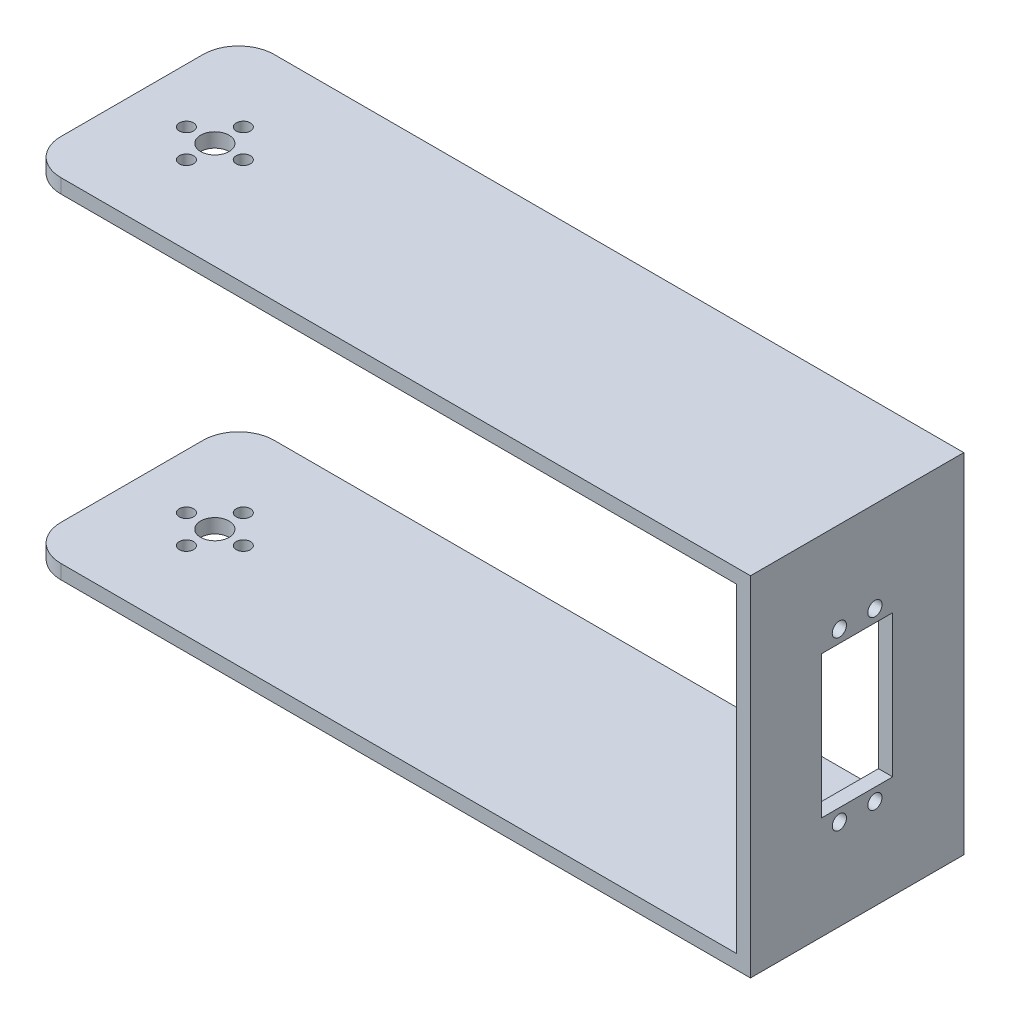
from build123d import *

# Parameters (mm, degrees)
EKSTR_ZYON_NCE1_DEPTH = 60
RADYUS1_R             = 10
KES_EKSTR_ZYON1_REACH = 236.137
IZIM2_R               = 4
IZIM2_R_2             = 2
KES_EKSTR_ZYON2_REACH = 234.491
IZIM3_R               = 2
IZIM3_W               = 20
IZIM3_H               = 40


with BuildPart() as part:
    # Çizim1 → Ekstrüzyon-İnce1 (new body)
    with BuildSketch(Plane.XY):
        Polygon((0, 0), (200, 0), (200, 90), (0, 90), (0, 94), (204, 94), (204, -4), (0, -4), align=None)
    extrude(amount=EKSTR_ZYON_NCE1_DEPTH)

    # Radyus1
    radyus1_edges = [part.edges().sort_by_distance(p)[0] for p in [
        (0, -2, 60),
        (0, 92, 60),
        (0, -2, 0),
        (0, 92, 0),
    ]]
    fillet(radyus1_edges, radius=RADYUS1_R)

    # Çizim2 → Kes-Ekstrüzyon1 (cut, up to next)
    with BuildSketch(Plane(origin=(0, 94, 0), x_dir=(1, 0, 0), z_dir=(0, 1, 0)), mode=Mode.PRIVATE) as kes_ekstr_zyon1_sk1:
        with Locations(Location((23.318126504, -30, 0), (0, 0, 270))):
            Circle(IZIM2_R)
    kes_ekstr_zyon1_tool1 = extrude(kes_ekstr_zyon1_sk1.sketch, amount=-KES_EKSTR_ZYON1_REACH, mode=Mode.PRIVATE) & part.part
    # Çizim2 → Kes-Ekstrüzyon1 (cut, up to next)
    with BuildSketch(Plane(origin=(0, 94, 0), x_dir=(1, 0, 0), z_dir=(0, 1, 0)), mode=Mode.PRIVATE) as kes_ekstr_zyon1_sk2:
        with Locations(Location((23.318126504, -22, 0), (0, 0, 270))):
            Circle(IZIM2_R_2)
    kes_ekstr_zyon1_tool2 = extrude(kes_ekstr_zyon1_sk2.sketch, amount=-KES_EKSTR_ZYON1_REACH, mode=Mode.PRIVATE) & part.part
    # Çizim2 → Kes-Ekstrüzyon1 (cut, up to next)
    with BuildSketch(Plane(origin=(0, 94, 0), x_dir=(1, 0, 0), z_dir=(0, 1, 0)), mode=Mode.PRIVATE) as kes_ekstr_zyon1_sk3:
        with Locations(Location((23.318126504, -38, 0), (0, 0, 270))):
            Circle(IZIM2_R_2)
    kes_ekstr_zyon1_tool3 = extrude(kes_ekstr_zyon1_sk3.sketch, amount=-KES_EKSTR_ZYON1_REACH, mode=Mode.PRIVATE) & part.part
    # Çizim2 → Kes-Ekstrüzyon1 (cut, up to next)
    with BuildSketch(Plane(origin=(0, 94, 0), x_dir=(1, 0, 0), z_dir=(0, 1, 0)), mode=Mode.PRIVATE) as kes_ekstr_zyon1_sk4:
        with Locations(Location((31.318126504, -30, 0), (0, 0, 270))):
            Circle(IZIM2_R_2)
    kes_ekstr_zyon1_tool4 = extrude(kes_ekstr_zyon1_sk4.sketch, amount=-KES_EKSTR_ZYON1_REACH, mode=Mode.PRIVATE) & part.part
    # Çizim2 → Kes-Ekstrüzyon1 (cut, up to next)
    with BuildSketch(Plane(origin=(0, 94, 0), x_dir=(1, 0, 0), z_dir=(0, 1, 0)), mode=Mode.PRIVATE) as kes_ekstr_zyon1_sk5:
        with Locations(Location((15.318126504, -30, 0), (0, 0, 270))):
            Circle(IZIM2_R_2)
    kes_ekstr_zyon1_tool5 = extrude(kes_ekstr_zyon1_sk5.sketch, amount=-KES_EKSTR_ZYON1_REACH, mode=Mode.PRIVATE) & part.part
    kes_ekstr_zyon1_1 = kes_ekstr_zyon1_tool1.solids().sort_by_distance((23.318127, 94, 30))[0]
    add(kes_ekstr_zyon1_1, mode=Mode.SUBTRACT)
    kes_ekstr_zyon1_2 = kes_ekstr_zyon1_tool2.solids().sort_by_distance((23.318127, 94, 22))[0]
    add(kes_ekstr_zyon1_2, mode=Mode.SUBTRACT)
    kes_ekstr_zyon1_3 = kes_ekstr_zyon1_tool3.solids().sort_by_distance((23.318127, 94, 38))[0]
    add(kes_ekstr_zyon1_3, mode=Mode.SUBTRACT)
    kes_ekstr_zyon1_4 = kes_ekstr_zyon1_tool4.solids().sort_by_distance((31.318127, 94, 30))[0]
    add(kes_ekstr_zyon1_4, mode=Mode.SUBTRACT)
    kes_ekstr_zyon1_5 = kes_ekstr_zyon1_tool5.solids().sort_by_distance((15.318127, 94, 30))[0]
    add(kes_ekstr_zyon1_5, mode=Mode.SUBTRACT)
    kes_ekstr_zyon1 = kes_ekstr_zyon1_1 + kes_ekstr_zyon1_2 + kes_ekstr_zyon1_3 + kes_ekstr_zyon1_4 + kes_ekstr_zyon1_5  # Kes-Ekstrüzyon1 as one shape, for the pattern or mirror that repeats it

    # Aynalama1: Kes-Ekstrüzyon1 across plane
    add(kes_ekstr_zyon1.mirror(Plane.ZX.offset(45)), mode=Mode.SUBTRACT)

    # Çizim3 → Kes-Ekstrüzyon2 (cut, up to next)
    with BuildSketch(Plane(origin=(204, 0, 0), x_dir=(0, 0, -1), z_dir=(1, 0, 0)), mode=Mode.PRIVATE) as kes_ekstr_zyon2_sk1:
        with Locations((-25, 68.5)):
            Circle(IZIM3_R)
    kes_ekstr_zyon2_tool1 = extrude(kes_ekstr_zyon2_sk1.sketch, amount=-KES_EKSTR_ZYON2_REACH, mode=Mode.PRIVATE) & part.part
    # Çizim3 → Kes-Ekstrüzyon2 (cut, up to next)
    with BuildSketch(Plane(origin=(204, 0, 0), x_dir=(0, 0, -1), z_dir=(1, 0, 0)), mode=Mode.PRIVATE) as kes_ekstr_zyon2_sk2:
        with Locations(Location((-35, 68.5, 0), (0, 0, 180))):
            Circle(IZIM3_R)
    kes_ekstr_zyon2_tool2 = extrude(kes_ekstr_zyon2_sk2.sketch, amount=-KES_EKSTR_ZYON2_REACH, mode=Mode.PRIVATE) & part.part
    # Çizim3 → Kes-Ekstrüzyon2 (cut, up to next)
    with BuildSketch(Plane(origin=(204, 0, 0), x_dir=(0, 0, -1), z_dir=(1, 0, 0)), mode=Mode.PRIVATE) as kes_ekstr_zyon2_sk3:
        with Locations(Location((-25, 21.5, 0), (0, 0, 180))):
            Circle(IZIM3_R)
    kes_ekstr_zyon2_tool3 = extrude(kes_ekstr_zyon2_sk3.sketch, amount=-KES_EKSTR_ZYON2_REACH, mode=Mode.PRIVATE) & part.part
    # Çizim3 → Kes-Ekstrüzyon2 (cut, up to next)
    with BuildSketch(Plane(origin=(204, 0, 0), x_dir=(0, 0, -1), z_dir=(1, 0, 0)), mode=Mode.PRIVATE) as kes_ekstr_zyon2_sk4:
        with Locations((-35, 21.5)):
            Circle(IZIM3_R)
    kes_ekstr_zyon2_tool4 = extrude(kes_ekstr_zyon2_sk4.sketch, amount=-KES_EKSTR_ZYON2_REACH, mode=Mode.PRIVATE) & part.part
    # Çizim3 → Kes-Ekstrüzyon2 (cut, up to next)
    with BuildSketch(Plane(origin=(204, 0, 0), x_dir=(0, 0, -1), z_dir=(1, 0, 0)), mode=Mode.PRIVATE) as kes_ekstr_zyon2_sk5:
        with Locations((-30, 45)):
            Rectangle(IZIM3_W, IZIM3_H)
    kes_ekstr_zyon2_tool5 = extrude(kes_ekstr_zyon2_sk5.sketch, amount=-KES_EKSTR_ZYON2_REACH, mode=Mode.PRIVATE) & part.part
    add(kes_ekstr_zyon2_tool1.solids().sort_by_distance((204, 68.5, 25))[0], mode=Mode.SUBTRACT)
    add(kes_ekstr_zyon2_tool2.solids().sort_by_distance((204, 68.5, 35))[0], mode=Mode.SUBTRACT)
    add(kes_ekstr_zyon2_tool3.solids().sort_by_distance((204, 21.5, 25))[0], mode=Mode.SUBTRACT)
    add(kes_ekstr_zyon2_tool4.solids().sort_by_distance((204, 21.5, 35))[0], mode=Mode.SUBTRACT)
    add(kes_ekstr_zyon2_tool5.solids().sort_by_distance((204, 45, 30))[0], mode=Mode.SUBTRACT)


solid = part.part
